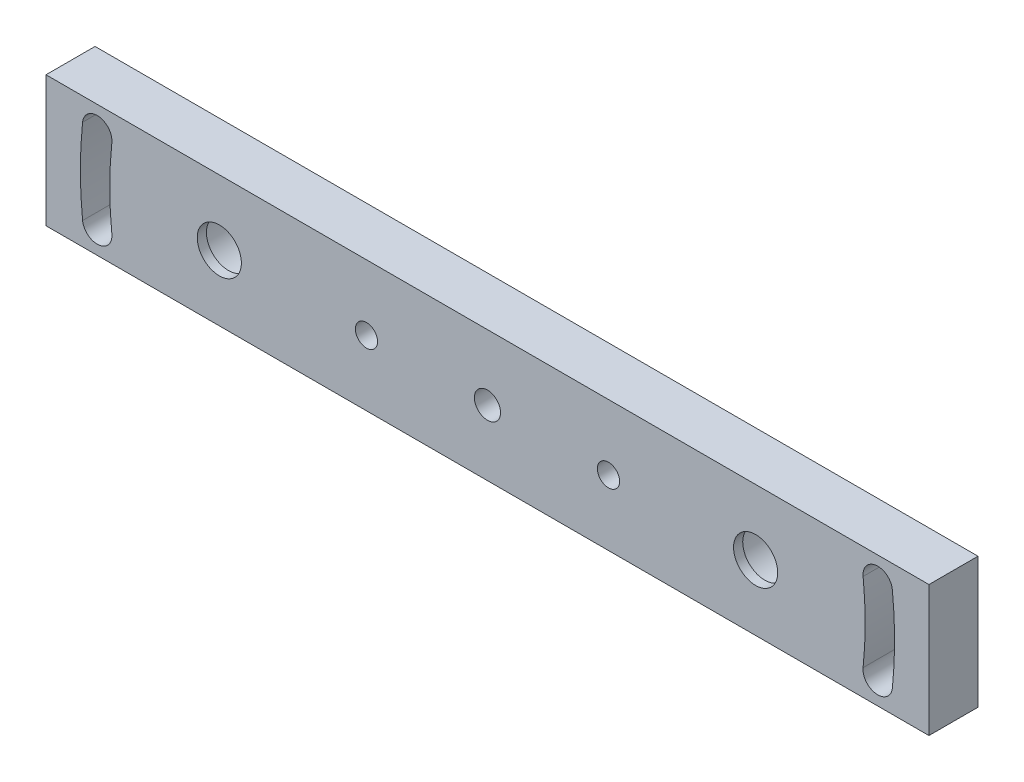
from build123d import *

# Parameters (mm, degrees)
SKETCH_1_W                = 270
SKETCH_1_H                = 40
EXTRUDE_1_DEPTH           = 15
HOLE_WIZARD_1_D           = 13.5
HOLE_WIZARD_1_CBORE_D     = 20
HOLE_WIZARD_1_CBORE_DEPTH = 12.2
CUT_EXTRUDE_1_DEPTH       = 138.295302177
HOLE_WIZARD_M8_1_D        = 6.8
HOLE_WIZARD_1_2_D         = 8


with BuildPart() as part:
    # 草图1 → 凸台-拉伸1 (new body)
    with BuildSketch(Plane.XY):
        Rectangle(SKETCH_1_W, SKETCH_1_H)
    extrude(amount=EXTRUDE_1_DEPTH)

    # Hole Wizard 1 (through all)
    with Locations(Plane(origin=(0, 0, 0), x_dir=(-1, 0, 0), z_dir=(0, 0, -1))):
        with Locations((-82, 0), (82, 0)):
            CounterBoreHole(HOLE_WIZARD_1_D / 2, HOLE_WIZARD_1_CBORE_D / 2, HOLE_WIZARD_1_CBORE_DEPTH)

    # 草图4 → 切除-拉伸1 (cut, through all)
    with BuildSketch(Plane.XY.offset(15)):
        with BuildLine():
            ThreePointArc((114.867278915, -12.073037507), (115.5, 0), (114.867278915, 12.073037507))
            ThreePointArc((114.867278915, 12.073037507), (118.872249359, 17.018764121), (123.817975973, 13.013793677))
            ThreePointArc((123.817975973, 13.013793677), (124.5, 0), (123.817975973, -13.013793677))
            ThreePointArc((123.817975973, -13.013793677), (118.872249359, -17.018764121), (114.867278915, -12.073037507))
        make_face()
        with BuildLine():
            ThreePointArc((-114.867278915, -12.073037507), (-118.872249359, -17.018764121), (-123.817975973, -13.013793677))
            ThreePointArc((-123.817975973, -13.013793677), (-124.5, 0), (-123.817975973, 13.013793677))
            ThreePointArc((-123.817975973, 13.013793677), (-118.872249359, 17.018764121), (-114.867278915, 12.073037507))
            ThreePointArc((-114.867278915, 12.073037507), (-115.5, 0), (-114.867278915, -12.073037507))
        make_face()
    extrude(amount=-CUT_EXTRUDE_1_DEPTH, mode=Mode.SUBTRACT)

    # M8 螺纹孔1 (through all)
    with Locations(Plane.XY.offset(15)):
        with Locations((-37, 0), (37, 0)):
            Hole(HOLE_WIZARD_M8_1_D / 2)

    # Hole Wizard 1 2 (through all)
    with Locations(Plane(origin=(0, 0, 0), x_dir=(-1, 0, 0), z_dir=(0, 0, -1))):
        with Locations((0, 0)):
            Hole(HOLE_WIZARD_1_2_D / 2)


solid = part.part
